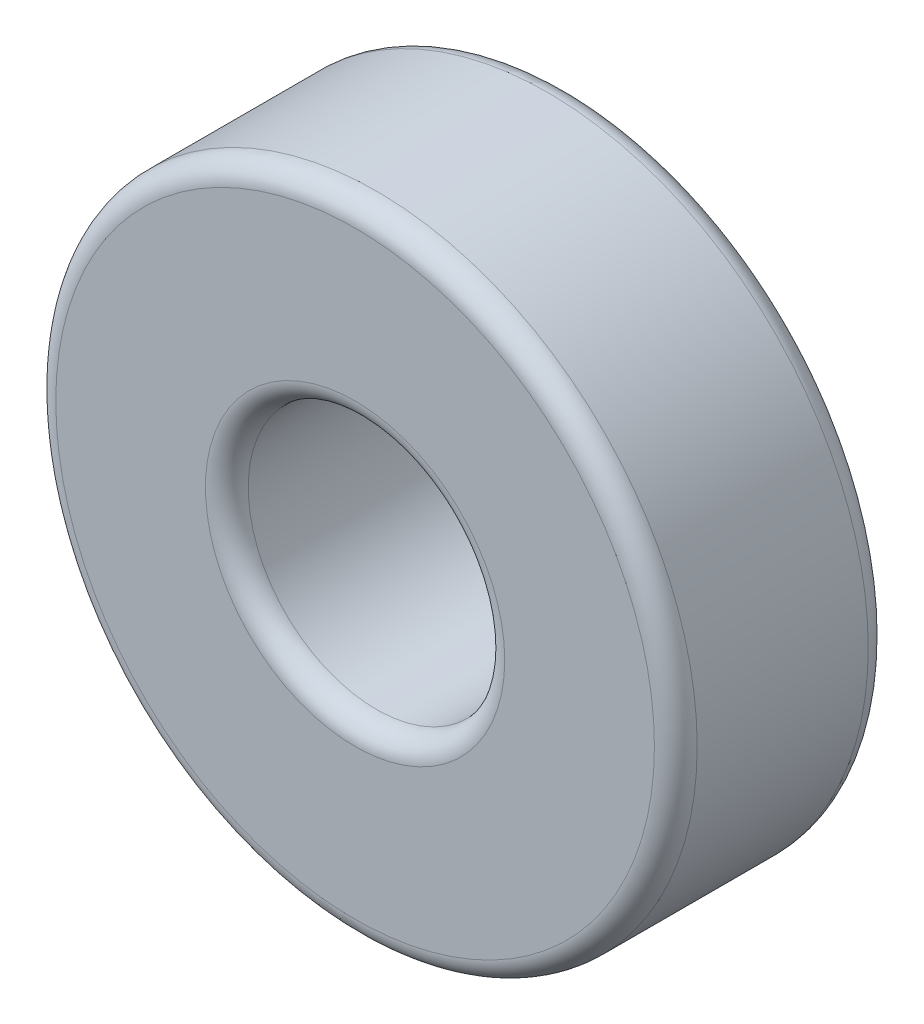
from build123d import *

# Parameters (mm, degrees)
ESQUISSE1_R        = 7.5
ESQUISSE1_R_2      = 3
BOSS_EXTRU_1_DEPTH = 5
CONG_1_R           = 0.5


with BuildPart() as part:
    # Esquisse1 → Boss.-Extru.1 (new body)
    with BuildSketch(Plane.XY):
        Circle(ESQUISSE1_R)
        Circle(ESQUISSE1_R_2, mode=Mode.SUBTRACT)
    extrude(amount=BOSS_EXTRU_1_DEPTH)

    # Congé1
    cong_1_edges = [part.edges().sort_by_distance(p)[0] for p in [
        (-7.5, 0, 0),
        (-7.5, 0, 5),
        (-3, 0, 0),
        (-3, 0, 5),
    ]]
    fillet(cong_1_edges, radius=CONG_1_R)


solid = part.part
